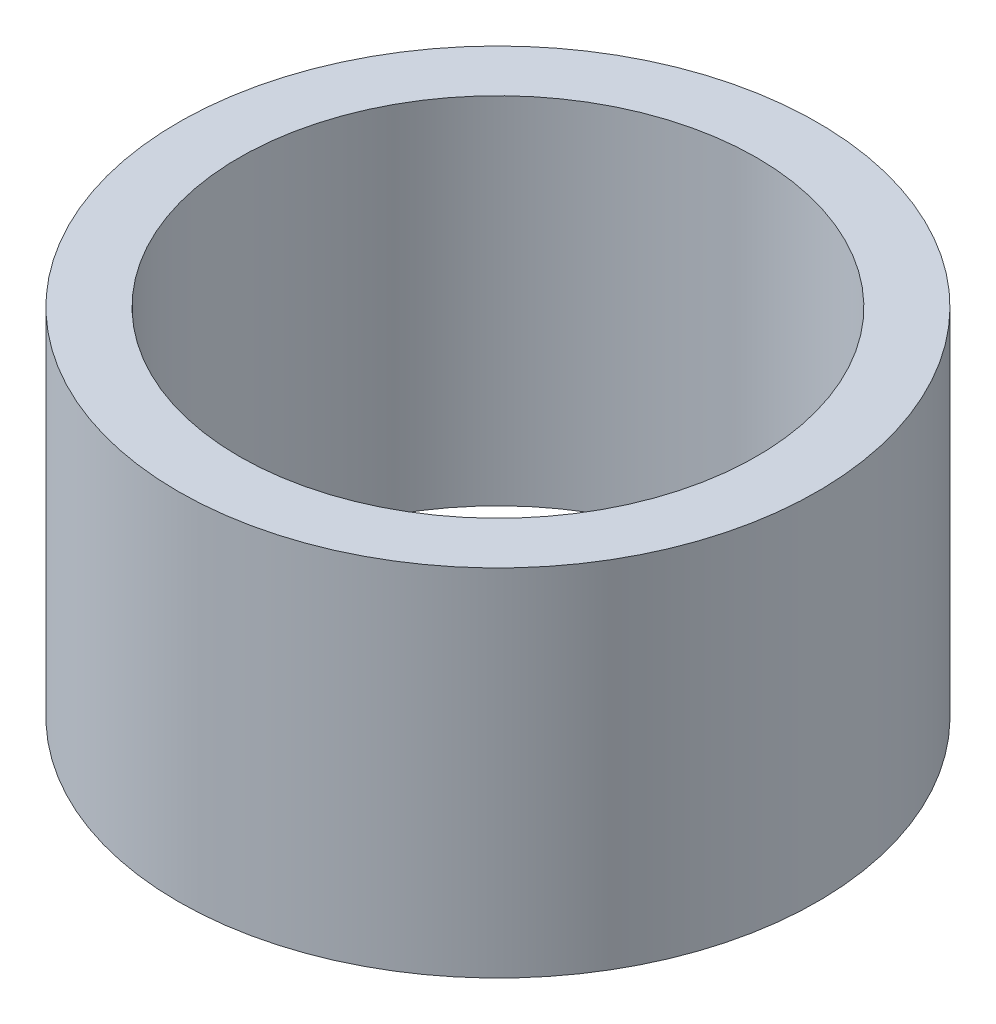
from build123d import *

# Parameters (mm, degrees)
SKETCH1_R           = 3.15
SKETCH1_R_2         = 2.55
BOSS_EXTRUDE1_DEPTH = 3.5


with BuildPart() as part:
    # Sketch1 → Boss-Extrude1 (new body)
    with BuildSketch(Plane(origin=(0, 0, 0), x_dir=(1, 0, 0), z_dir=(0, 1, 0))):
        with Locations(Location((0, 0, 0), (0, 0, 270))):
            Circle(SKETCH1_R)
        with Locations(Location((0, 0, 0), (0, 0, 270))):
            Circle(SKETCH1_R_2, mode=Mode.SUBTRACT)
    extrude(amount=BOSS_EXTRUDE1_DEPTH)


solid = part.part
